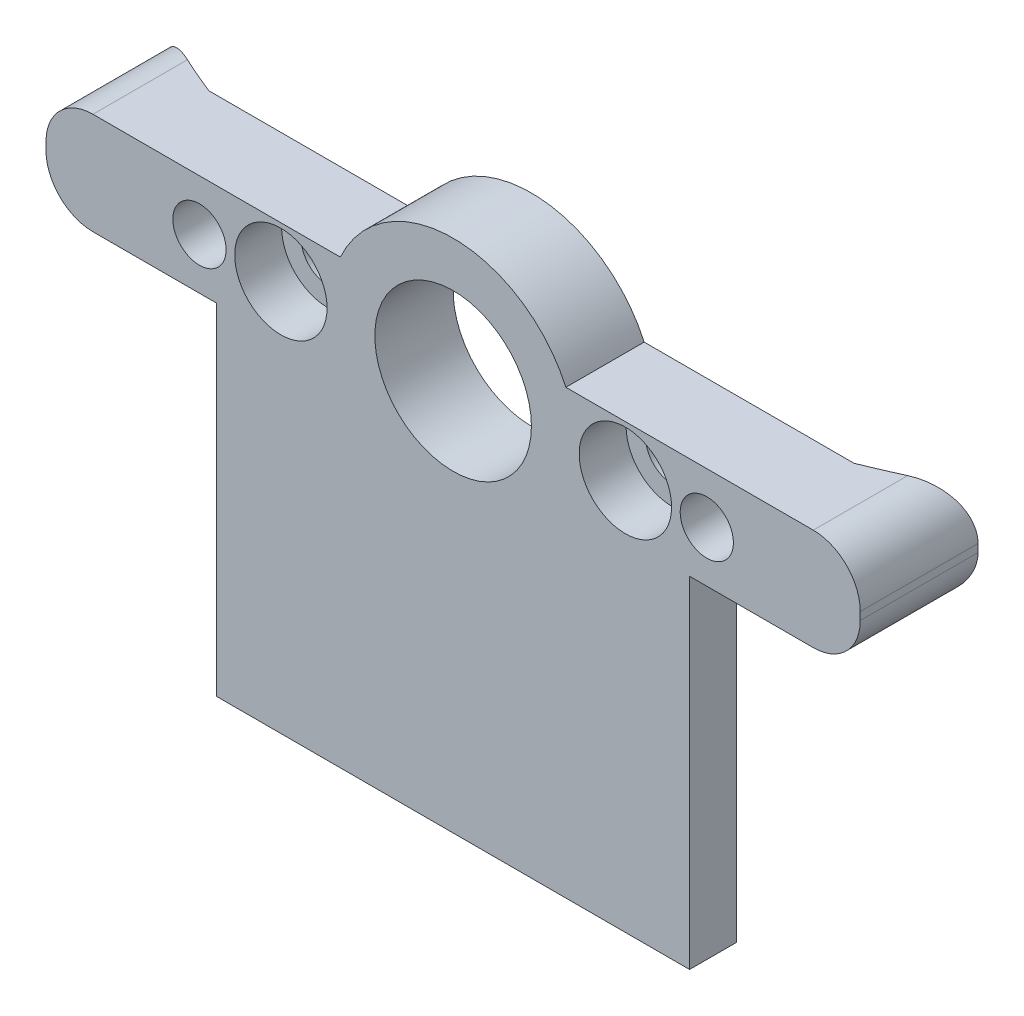
from build123d import *

# Parameters (mm, degrees)
CROQUIS1_R                          = 5
SALIENTE_EXTRUIR1_DEPTH             = 5
CROQUIS2_R                          = 1.7
CORTAR_EXTRUIR1_DEPTH               = 5
CROQUIS3_R                          = 2.95
CORTAR_EXTRUIR2_DEPTH               = 3
SALIENTE_EXTRUIR2_REACH             = 29.63
SALIENTE_EXTRUIR2_DIRECTION_2_REACH = 29.63
CROQUIS5_R                          = 1.7
CORTAR_EXTRUIR3_DEPTH               = 10
CORTAR_EXTRUIR4_DEPTH               = 1.7
REDONDEO1_R                         = 3
SALIENTE_EXTRUIR3_START             = -2.5
SALIENTE_EXTRUIR3_DEPTH             = 2.5
SALIENTE_EXTRUIR4_DEPTH             = 21.75


with BuildPart() as part:
    # Croquis1 → Saliente-Extruir1 (new body)
    with BuildSketch(Plane.XY):
        with BuildLine():
            Line((-7.200520814, 3.25), (-26, 3.25))
            Line((-26, 3.25), (-26, -3.25))
            Line((-26, -3.25), (-7.200520814, -3.25))
            ThreePointArc((-7.200520814, -3.25), (0, -7.9), (7.200520814, -3.25))
            Line((7.200520814, -3.25), (26, -3.25))
            Line((26, -3.25), (26, 3.25))
            Line((26, 3.25), (7.200520814, 3.25))
            ThreePointArc((7.200520814, 3.25), (0, 7.9), (-7.200520814, 3.25))
        make_face()
        Circle(CROQUIS1_R, mode=Mode.SUBTRACT)
    extrude(amount=SALIENTE_EXTRUIR1_DEPTH)

    # Croquis2 → Cortar-Extruir1 (cut)
    with BuildSketch(Plane.XY.offset(5)):
        with Locations((-11, 0)):
            Circle(CROQUIS2_R)
        with Locations((11, 0)):
            Circle(CROQUIS2_R)
    extrude(amount=-CORTAR_EXTRUIR1_DEPTH, mode=Mode.SUBTRACT)

    # Croquis3 → Cortar-Extruir2 (cut)
    with BuildSketch(Plane.XY.offset(5)):
        with Locations((-11, 0)):
            Circle(CROQUIS3_R)
        with Locations((11, 0)):
            Circle(CROQUIS3_R)
    extrude(amount=-CORTAR_EXTRUIR2_DEPTH, mode=Mode.SUBTRACT)

    # Saliente-Extruir2: up to this face of the body (flat: up to its plane)
    saliente_extruir2_end = Plane(part.part.faces().sort_by_distance((-16.600260407, 3.25, 2.5))[0])
    # Croquis4 → Saliente-Extruir2 (add, up to the picked face)
    with BuildSketch(Plane(origin=(0, 0, 0), x_dir=(1, 0, 0), z_dir=(0, 1, 0)), mode=Mode.PRIVATE) as saliente_extruir2_sk1:
        with BuildLine():
            Line((-26, 0), (-20.6, 0))
            ThreePointArc((-20.6, 0), (-23.334154241, 1.186812342), (-26, 2.52))
            Line((-26, 2.52), (-26, 0))
        make_face()
    saliente_extruir2_tool1 = split(extrude(saliente_extruir2_sk1.sketch, amount=SALIENTE_EXTRUIR2_REACH, mode=Mode.PRIVATE), bisect_by=saliente_extruir2_end, keep=Keep.BOTH, mode=Mode.PRIVATE)
    saliente_extruir2 = saliente_extruir2_tool1.solids().sort_by(Axis((-24.243872, 0, -0.82066), (0, 1, 0)))[0]
    add(saliente_extruir2)

    # Saliente-Extruir2 direction 2: up to this face of the body (flat: up to its plane)
    saliente_extruir2_direction_2_end = Plane(part.part.faces().sort_by_distance((-16.600260407, -3.25, 2.5))[0])
    # Croquis4 → Saliente-Extruir2 direction 2 (add, up to the picked face)
    with BuildSketch(Plane(origin=(0, 0, 0), x_dir=(1, 0, 0), z_dir=(0, 1, 0)), mode=Mode.PRIVATE) as saliente_extruir2_direction_2_sk1:
        with BuildLine():
            Line((-26, 0), (-20.6, 0))
            ThreePointArc((-20.6, 0), (-23.334154241, 1.186812342), (-26, 2.52))
            Line((-26, 2.52), (-26, 0))
        make_face()
    saliente_extruir2_direction_2_tool1 = split(extrude(saliente_extruir2_direction_2_sk1.sketch, amount=-SALIENTE_EXTRUIR2_DIRECTION_2_REACH, mode=Mode.PRIVATE), bisect_by=saliente_extruir2_direction_2_end, keep=Keep.BOTH, mode=Mode.PRIVATE)
    saliente_extruir2_direction_2 = saliente_extruir2_direction_2_tool1.solids().sort_by(Axis((-24.243872, 0, -0.82066), (0, -1, 0)))[0]
    add(saliente_extruir2_direction_2)

    # Croquis5 → Cortar-Extruir3 (cut)
    with BuildSketch(Plane.XY.offset(5)):
        with Locations((-16.2, 0)):
            Circle(CROQUIS5_R)
    cortar_extruir3 = extrude(amount=-CORTAR_EXTRUIR3_DEPTH, mode=Mode.SUBTRACT)

    # Croquis6 → Cortar-Extruir4 (cut)
    with BuildSketch(Plane(origin=(0, 0, 0), x_dir=(-1, 0, 0), z_dir=(0, 0, -1))):
        Polygon((19.55, 0), (17.875, 2.901185103), (14.525, 2.901185103), (12.85, 0), (14.525, -2.901185103), (17.875, -2.901185103), align=None)
    cortar_extruir4 = extrude(amount=-CORTAR_EXTRUIR4_DEPTH, mode=Mode.SUBTRACT)

    # Simetría2: Saliente-Extruir2, Saliente-Extruir2 direction 2, Cortar-Extruir3, Cortar-Extruir4 across plane
    add(saliente_extruir2.mirror(Plane(origin=(0, 0, 0), x_dir=(0, 0, 1), z_dir=(1, 0, 0))))
    add(saliente_extruir2_direction_2.mirror(Plane(origin=(0, 0, 0), x_dir=(0, 0, 1), z_dir=(1, 0, 0))))
    add(cortar_extruir3.mirror(Plane(origin=(0, 0, 0), x_dir=(0, 0, 1), z_dir=(1, 0, 0))), mode=Mode.SUBTRACT)
    add(cortar_extruir4.mirror(Plane(origin=(0, 0, 0), x_dir=(0, 0, 1), z_dir=(1, 0, 0))), mode=Mode.SUBTRACT)

    # Redondeo1
    redondeo1_edges = [part.edges().sort_by_distance(p)[0] for p in [
        (-26, 3.25, 1.24),
        (26, 3.25, 1.24),
        (26, -3.25, 1.24),
        (-26, -3.25, 1.24),
    ]]
    fillet(redondeo1_edges, radius=REDONDEO1_R)

    # Croquis7 → Saliente-Extruir3 (add)
    with BuildSketch(Plane.XY.offset(5).offset(SALIENTE_EXTRUIR3_START)):
        with BuildLine():
            Line((-15.100260407, -3.25), (-7.200520814, -3.25))
            ThreePointArc((-7.200520814, -3.25), (0, -7.9), (7.200520814, -3.25))
            Line((7.200520814, -3.25), (15.100260407, -3.25))
            Line((15.100260407, -3.25), (15.100260407, -25))
            Line((15.100260407, -25), (-15.100260407, -25))
            Line((-15.100260407, -25), (-15.100260407, -3.25))
        make_face()
    extrude(amount=SALIENTE_EXTRUIR3_DEPTH)

    # Croquis8 → Saliente-Extruir4 (add)
    with BuildSketch(Plane.XZ.offset(25)):
        with BuildLine():
            Line((-15.100260407, 2.5), (-15.100260407, 2))
            ThreePointArc((-15.100260407, 2), (-13.952935396, 2.262304947), (-12.800260407, 2.5))
            Line((-12.800260407, 2.5), (-15.100260407, 2.5))
        make_face()
        with BuildLine():
            Line((15.100260407, 2.5), (12.800260407, 2.5))
            ThreePointArc((12.800260407, 2.5), (13.952935396, 2.262304947), (15.100260407, 2))
            Line((15.100260407, 2), (15.100260407, 2.5))
        make_face()
    extrude(amount=-SALIENTE_EXTRUIR4_DEPTH)


solid = part.part
